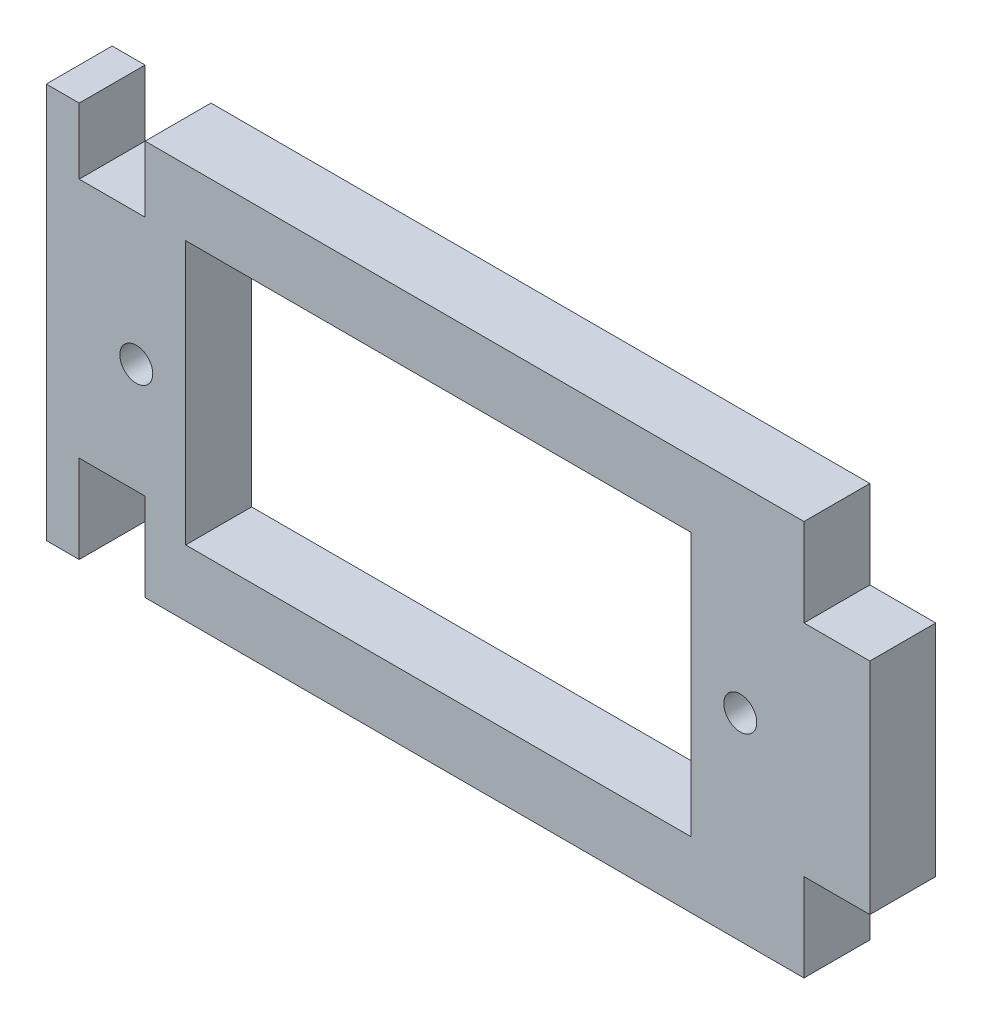
from build123d import *

# Parameters (mm, degrees)
SKETCH_1_R      = 1.5
SKETCH_1_R_2    = 0.75
EXTRUDE_9_DEPTH = 3


with BuildPart() as part:
    # 草图1 → 凸台-拉伸9 (new body)
    # profile 1 of 2: a face of its own
    with BuildSketch(Plane.XY):
        Polygon((37.5, -4), (37.5, -14), (34.5, -14), (34.5, -18), (4.5, -18), (4.5, -14), (1.5, -14), (1.5, -18), (0, -18), (0, 0), (1.5, 0), (1.5, -3), (4.5, -3), (4.5, 0), (34.5, 0), (34.5, -4), align=None)
        with Locations((36, -9)):
            Circle(SKETCH_1_R, mode=Mode.SUBTRACT)
        with Locations((4.1, -9)):
            Circle(SKETCH_1_R_2, mode=Mode.SUBTRACT)
        with Locations((31.6, -9)):
            Circle(SKETCH_1_R_2, mode=Mode.SUBTRACT)
        Polygon((29.35, -15), (6.35, -15), (6.35, -9), (6.35, -3), (29.35, -3), align=None, mode=Mode.SUBTRACT)
    # profile 2 of 2: a face of its own
    with BuildSketch(Plane.XY):
        with Locations((36, -9)):
            Circle(SKETCH_1_R)
    extrude(amount=EXTRUDE_9_DEPTH)


solid = part.part
